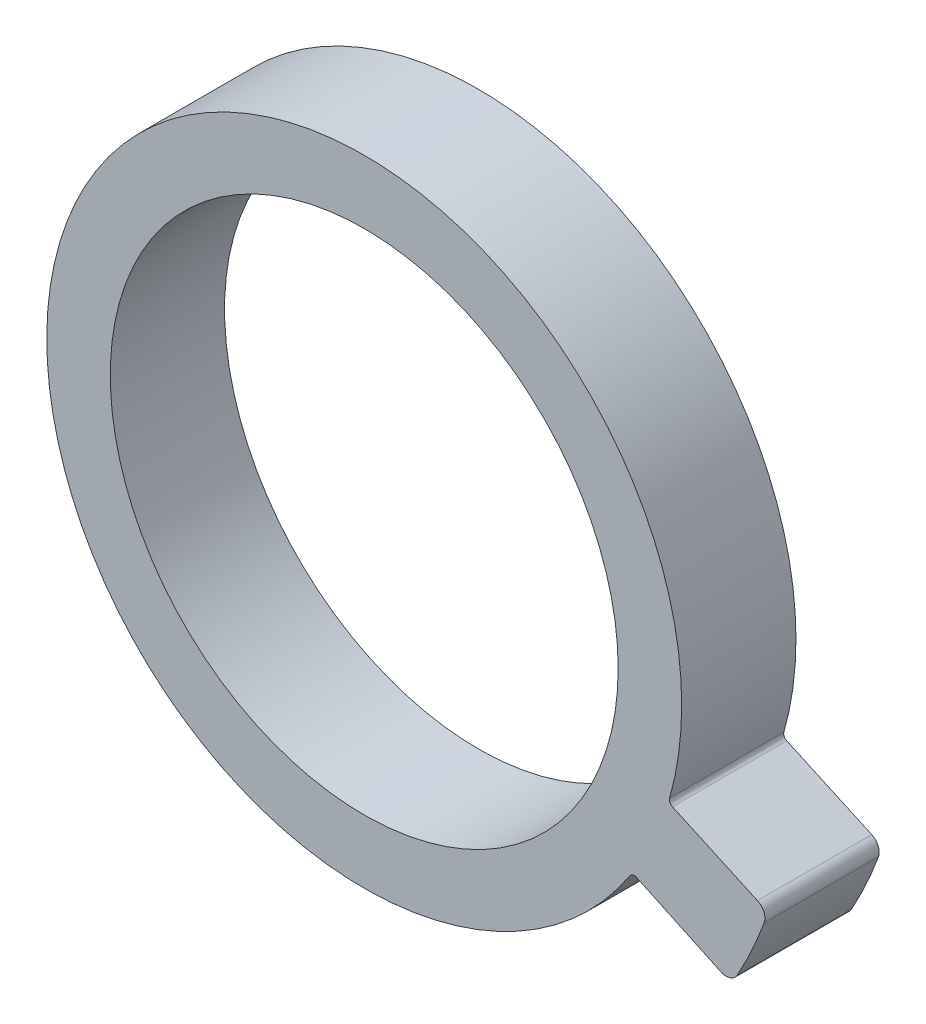
from build123d import *

# Parameters (mm, degrees)
ESQUISSE1_R        = 10
BOSS_EXTRU_3_DEPTH = 4.5


with BuildPart() as part:
    # Esquisse1 → Boss.-Extru.3 (new body)
    with BuildSketch(Plane.XY):
        with BuildLine():
            Line((15.485185595, -5.176669047), (12.134231543, -3.650742984))
            ThreePointArc((12.134231543, -3.650742984), (12.035609724, -3.552721892), (12.024721053, -3.414100701))
            ThreePointArc((12.024721053, -3.414100701), (-11.374079439, 5.184623122), (10.464430261, -6.837082661))
            ThreePointArc((10.464430261, -6.837082661), (10.577237298, -6.754079946), (10.716830338, -6.765422852))
            Line((10.716830338, -6.765422852), (14.040747626, -8.325354826))
            ThreePointArc((14.040747626, -8.325354826), (14.40745115, -8.348324263), (14.690843755, -8.114470246))
            ThreePointArc((14.690843755, -8.114470246), (15.262737454, -6.979567539), (15.747114807, -5.80464408))
            ThreePointArc((15.747114807, -5.80464408), (15.739440197, -5.439232144), (15.485185595, -5.176669047))
        make_face()
        Circle(ESQUISSE1_R, mode=Mode.SUBTRACT)
    extrude(amount=BOSS_EXTRU_3_DEPTH)


solid = part.part
